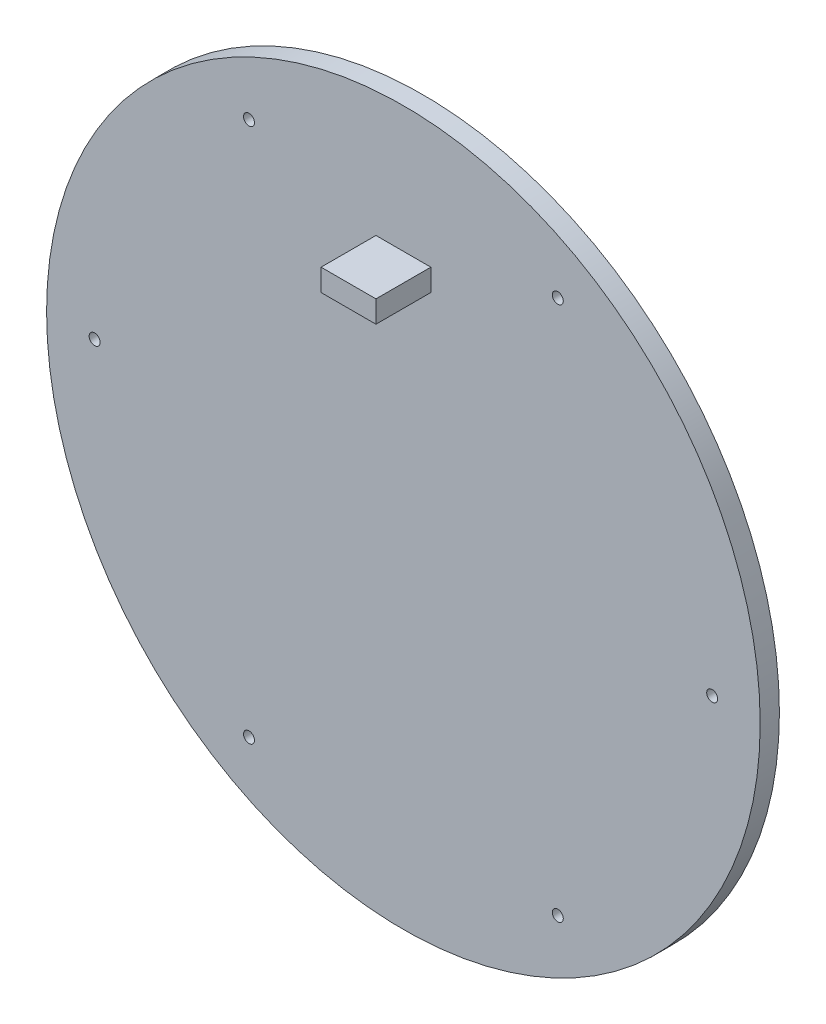
from build123d import *

# Parameters (mm, degrees)
SKETCH_1_R          = 65
EXTRUDE_1_DEPTH     = 3.5
SKETCH_2_W          = 10
SKETCH_2_H          = 4
EXTRUDE_2_DEPTH     = 10
SKETCH_3_R          = 1
CUT_EXTRUDE_1_DEPTH = 10


with BuildPart() as part:
    # 草图1 → 凸台-拉伸1 (new body)
    with BuildSketch(Plane.XY):
        Circle(SKETCH_1_R)
    extrude(amount=EXTRUDE_1_DEPTH)

    # 草图2 → 凸台-拉伸2 (add, symmetric)
    with BuildSketch(Plane.XY.offset(3.5)):
        with Locations((0, 40)):
            Rectangle(SKETCH_2_W, SKETCH_2_H)
    extrude(amount=EXTRUDE_2_DEPTH, both=True)

    # 草图3 → 切除-拉伸1 (cut)
    with BuildSketch(Plane(origin=(0, 0, 0), x_dir=(-1, 0, 0), z_dir=(0, 0, -1))):
        with Locations((56.25, 0)):
            Circle(SKETCH_3_R)
        with Locations((28.125, -48.713928963)):
            Circle(SKETCH_3_R)
        with Locations((-28.125, -48.713928963)):
            Circle(SKETCH_3_R)
        with Locations((-56.25, 0)):
            Circle(SKETCH_3_R)
        with Locations((-28.125, 48.713928963)):
            Circle(SKETCH_3_R)
        with Locations((28.125, 48.713928963)):
            Circle(SKETCH_3_R)
    extrude(amount=-CUT_EXTRUDE_1_DEPTH, mode=Mode.SUBTRACT)


solid = part.part
